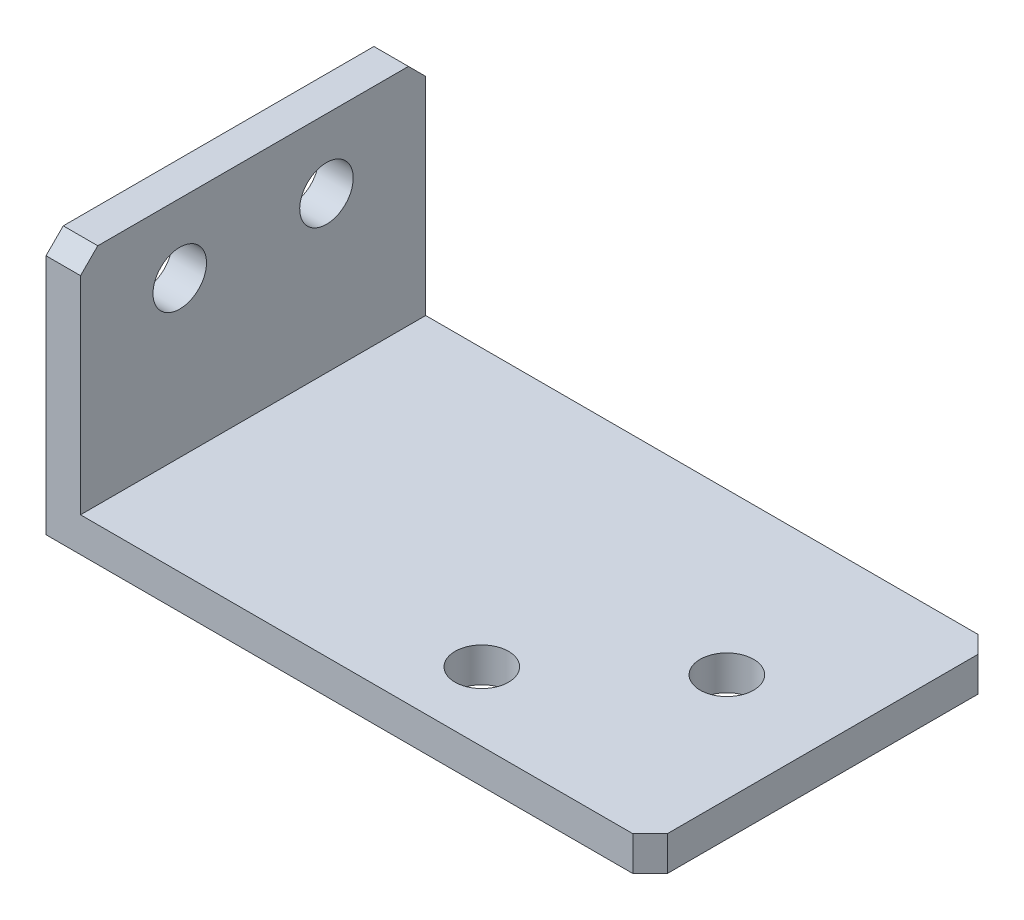
from build123d import *

# Parameters (mm, degrees)
BOSS_EXTRUDE1_DEPTH = 20
SKETCH2_R           = 1.55
CUT_EXTRUDE1_DEPTH  = 2
SKETCH5_R           = 1.55
CUT_EXTRUDE4_DEPTH  = 43.355637169
CHAMFER1_SIZE       = 1


with BuildPart() as part:
    # Sketch1 → Boss-Extrude1 (new body)
    with BuildSketch(Plane.XY):
        Polygon((0, 0), (35, 0), (35, 2), (2, 2), (2, 15), (0, 15), align=None)
    extrude(amount=BOSS_EXTRUDE1_DEPTH)

    # Sketch2 → Cut-Extrude1 (cut)
    with BuildSketch(Plane.ZY):
        with Locations(Location((14.25, 11, 0), (0, 0, 270))):
            Circle(SKETCH2_R)
        with Locations(Location((5.75, 11, 0), (0, 0, 270))):
            Circle(SKETCH2_R)
    extrude(amount=-CUT_EXTRUDE1_DEPTH, mode=Mode.SUBTRACT)

    # Sketch5 → Cut-Extrude4 (cut, through all)
    with BuildSketch(Plane(origin=(0, 2, 0), x_dir=(1, 0, 0), z_dir=(0, 1, 0))):
        with Locations(Location((21.25, -16, 0), (0, 0, 180))):
            Circle(SKETCH5_R)
        with Locations(Location((28.75, -9.3, 0), (0, 0, 180))):
            Circle(SKETCH5_R)
    extrude(amount=-CUT_EXTRUDE4_DEPTH, mode=Mode.SUBTRACT)

    # Chamfer1
    chamfer1_edges = [part.edges().sort_by_distance(p)[0] for p in [
        (35, 1, 20),
        (1, 15, 20),
        (1, 15, 0),
        (35, 1, 0),
    ]]
    chamfer(chamfer1_edges, length=CHAMFER1_SIZE)


solid = part.part
